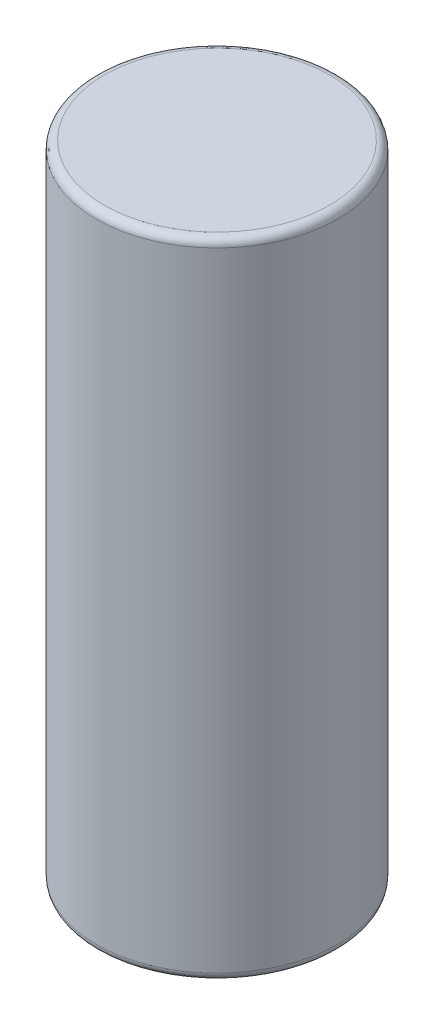
from build123d import *

# Parameters (mm, degrees)
SKETCH1_W = 75
SKETCH1_H = 400
FILLET1_R = 5


with BuildPart() as part:
    # Sketch1 → Revolve1 (revolve)
    with BuildSketch(Plane.XY):
        with Locations((37.5, 0)):
            Rectangle(SKETCH1_W, SKETCH1_H)
    revolve(axis=Axis((0, 0, 0), (0, 1, 0)))

    # Fillet1
    fillet1_edges = [part.edges().sort_by_distance(p)[0] for p in [
        (-75, -200, 0),
        (-75, 200, 0),
    ]]
    fillet(fillet1_edges, radius=FILLET1_R)


solid = part.part
